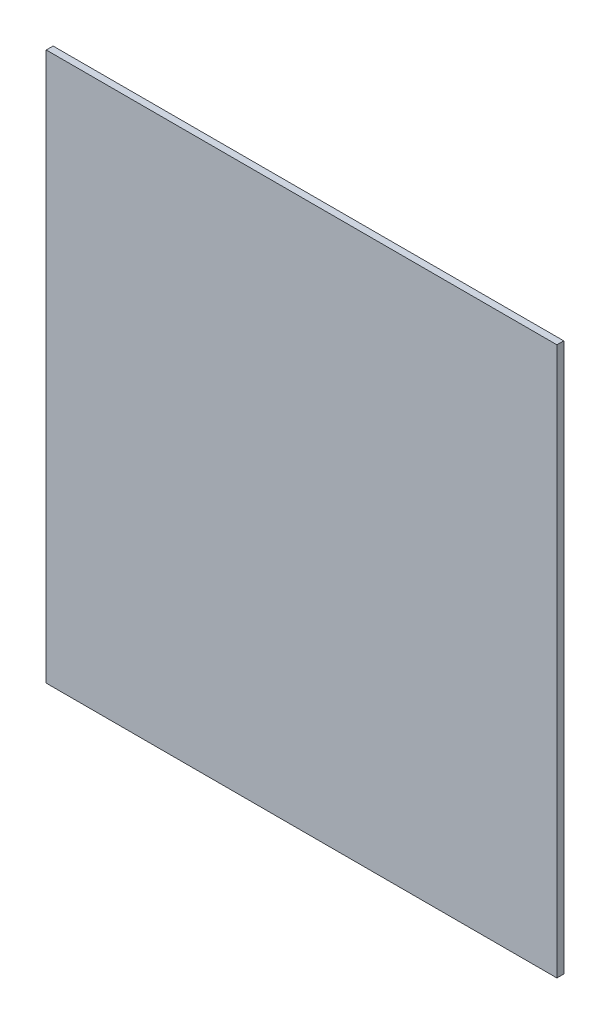
from build123d import *

# Parameters (mm, degrees)
SKETCH1_W           = 149
SKETCH1_H           = 160
BOSS_EXTRUDE1_DEPTH = 2


with BuildPart() as part:
    # Sketch1 → Boss-Extrude1 (new body)
    with BuildSketch(Plane.XY):
        Rectangle(SKETCH1_W, SKETCH1_H)
    extrude(amount=BOSS_EXTRUDE1_DEPTH)


solid = part.part
